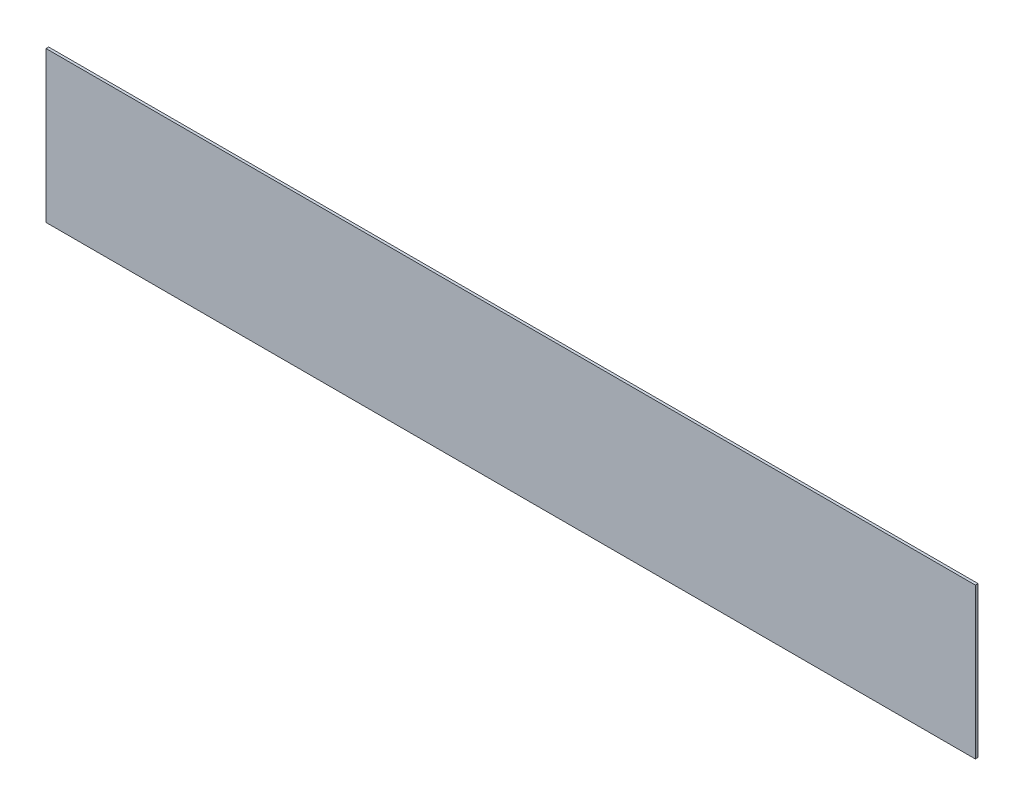
from build123d import *

# Parameters (mm, degrees)
SKETCH1_W           = 447
SKETCH1_H           = 72.46
BOSS_EXTRUDE1_DEPTH = 1.27


with BuildPart() as part:
    # Sketch1 → Boss-Extrude1 (new body)
    with BuildSketch(Plane.XY):
        with Locations((223.5, 36.23)):
            Rectangle(SKETCH1_W, SKETCH1_H)
    extrude(amount=BOSS_EXTRUDE1_DEPTH)


solid = part.part
